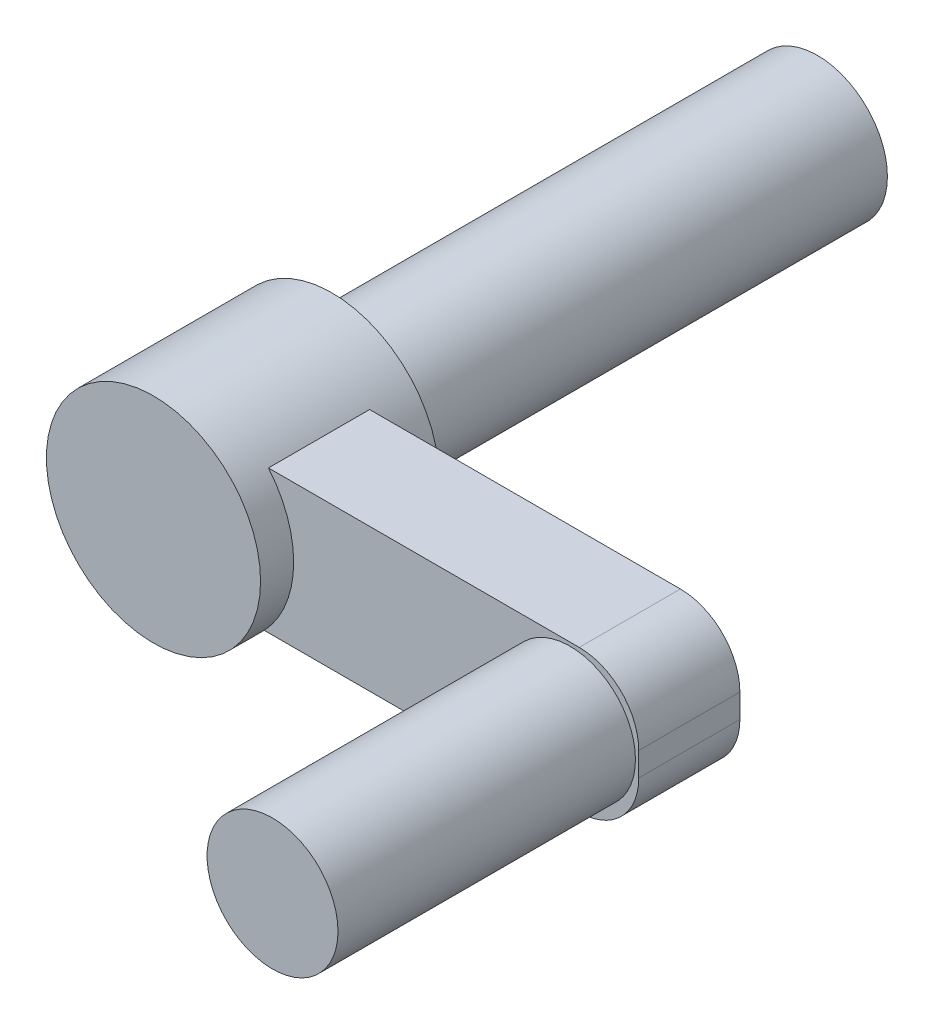
from build123d import *

# Parameters (mm, degrees)
SKETCH1_R           = 5.88
BOSS_EXTRUDE1_DEPTH = 40.8
SKETCH2_R           = 9
BOSS_EXTRUDE2_DEPTH = 15
SKETCH3_R           = 5
CUT_EXTRUDE1_DEPTH  = 40
SKETCH4_W           = 8.5
SKETCH4_H           = 12
BOSS_EXTRUDE4_DEPTH = 38
SKETCH5_R           = 5.5
BOSS_EXTRUDE5_DEPTH = 25
FILLET1_R           = 5
FILLET2_R           = 5


with BuildPart() as part:
    # Sketch1 → Boss-Extrude1 (new body)
    with BuildSketch(Plane.XY):
        Circle(SKETCH1_R)
    extrude(amount=BOSS_EXTRUDE1_DEPTH)

    # Sketch2 → Boss-Extrude2 (add)
    with BuildSketch(Plane.XY.offset(40.8)):
        Circle(SKETCH2_R)
    extrude(amount=BOSS_EXTRUDE2_DEPTH)

    # Sketch3 → Cut-Extrude1 (cut)
    with BuildSketch(Plane(origin=(0, 0, 0), x_dir=(-1, 0, 0), z_dir=(0, 0, -1))):
        Circle(SKETCH3_R)
    extrude(amount=-CUT_EXTRUDE1_DEPTH, mode=Mode.SUBTRACT)

    # Sketch4 → Boss-Extrude4 (add)
    with BuildSketch(Plane(origin=(0, 0, 0), x_dir=(0, 0, -1), z_dir=(1, 0, 0))):
        with Locations((-48.767868688, -0.197628396)):
            Rectangle(SKETCH4_W, SKETCH4_H)
    extrude(amount=BOSS_EXTRUDE4_DEPTH)

    # Sketch5 → Boss-Extrude5 (add)
    with BuildSketch(Plane.XY.offset(53.017868688)):
        with Locations((32.222684983, 0)):
            Circle(SKETCH5_R)
    extrude(amount=BOSS_EXTRUDE5_DEPTH)

    # Fillet1
    fillet1_edges = [part.edges().sort_by_distance(p)[0] for p in [
        (38, 5.802371604, 48.767868688),
    ]]
    fillet(fillet1_edges, radius=FILLET1_R)

    # Fillet2
    fillet2_edges = [part.edges().sort_by_distance(p)[0] for p in [
        (38, -6.197628396, 48.767868688),
    ]]
    fillet(fillet2_edges, radius=FILLET2_R)


solid = part.part
